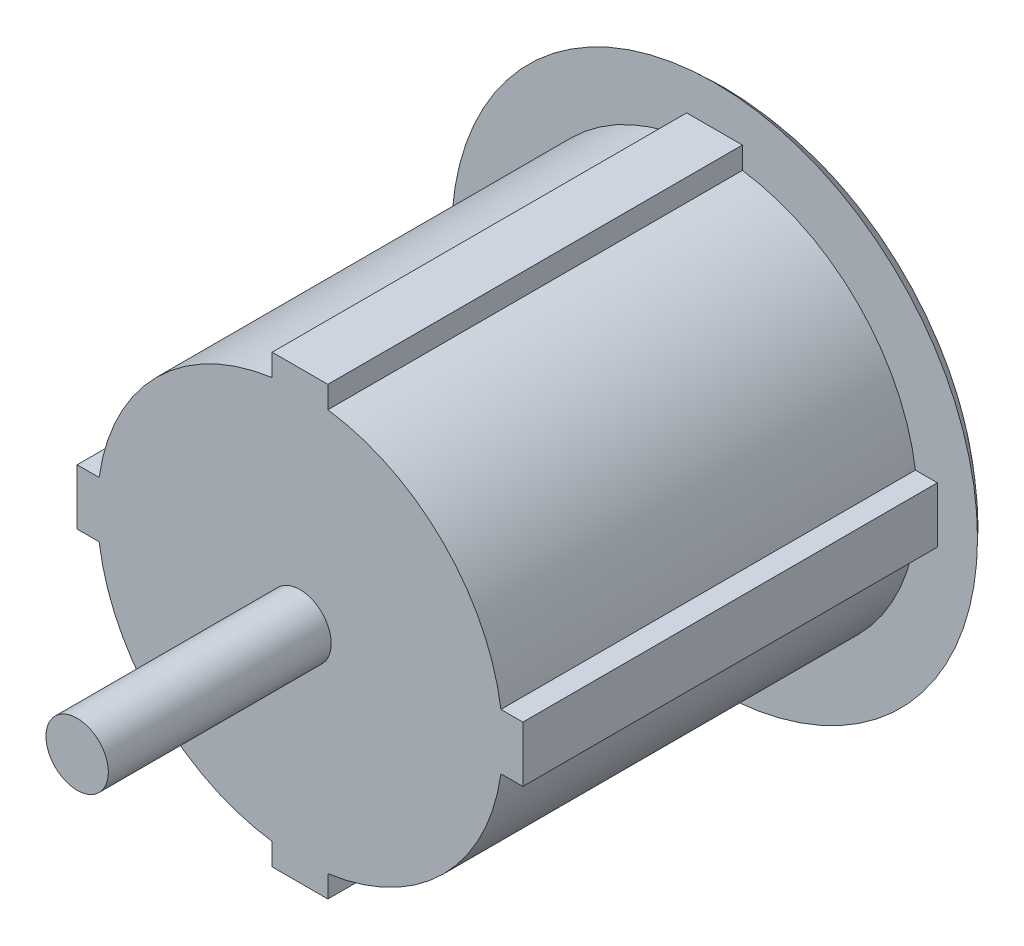
from build123d import *

# Parameters (mm, degrees)
SKETCH_1_R               = 9.1
EXTRUDE_1_DEPTH          = 20.4
SKETCH_3_R               = 8.294737136
SKETCH_3_R_2             = 7.294737136
CUT_EXTRUDE_1_DEPTH      = 0.5
SKETCH_4_W               = 2.5
SKETCH_4_H               = 2
EXTRUDE_2_DEPTH          = 18.6
PATTERN_CIRCULAR_1_COUNT = 4
SKETCH_5_R               = 1.4
EXTRUDE_3_DEPTH          = 10


with BuildPart() as part:
    # 草图1 → 凸台-拉伸1 (new body)
    with BuildSketch(Plane.XY):
        Circle(SKETCH_1_R)
    extrude(amount=EXTRUDE_1_DEPTH)

    # 草图2 → 旋转1 (revolve)
    with BuildSketch(Plane(origin=(0, 0, 0), x_dir=(0, 0, -1), z_dir=(1, 0, 0)), mode=Mode.PRIVATE) as revolve_1_sk:
        with BuildLine():
            Line((-1.8, 9.1), (-1.8, 11.8))
            ThreePointArc((-1.8, 11.8), (-0.714004188, 10.573997208), (0, 9.1))
            Line((0, 9.1), (-1.8, 9.1))
        make_face()
    revolve(revolve_1_sk.sketch.rotate(Axis((0, 0, 20.4), (0, 0, -1)), 270), axis=Axis((0, 0, 20.4), (0, 0, -1)))

    # 草图3 → 切除-拉伸1 (cut)
    with BuildSketch(Plane(origin=(0, 0, 0), x_dir=(-1, 0, 0), z_dir=(0, 0, -1))):
        Circle(SKETCH_3_R)
        Circle(SKETCH_3_R_2, mode=Mode.SUBTRACT)
    extrude(amount=-CUT_EXTRUDE_1_DEPTH, mode=Mode.SUBTRACT)

    # 草图4 → 凸台-拉伸2 (add)
    with BuildSketch(Plane.XY.offset(20.4)):
        with Locations((0, 9)):
            Rectangle(SKETCH_4_W, SKETCH_4_H)
    extrude_2 = extrude(amount=-EXTRUDE_2_DEPTH)

    # 阵列(圆周)1: 凸台-拉伸2 ×4 about axis
    pattern_circular_1_axis = Axis((0, 0, 0), (0, 0, 1))
    for i in range(1, PATTERN_CIRCULAR_1_COUNT):
        add(extrude_2.rotate(pattern_circular_1_axis, i * 360 / PATTERN_CIRCULAR_1_COUNT))

    # 草图5 → 凸台-拉伸3 (add)
    with BuildSketch(Plane.XY.offset(20.4)):
        Circle(SKETCH_5_R)
    extrude(amount=EXTRUDE_3_DEPTH)


solid = part.part
